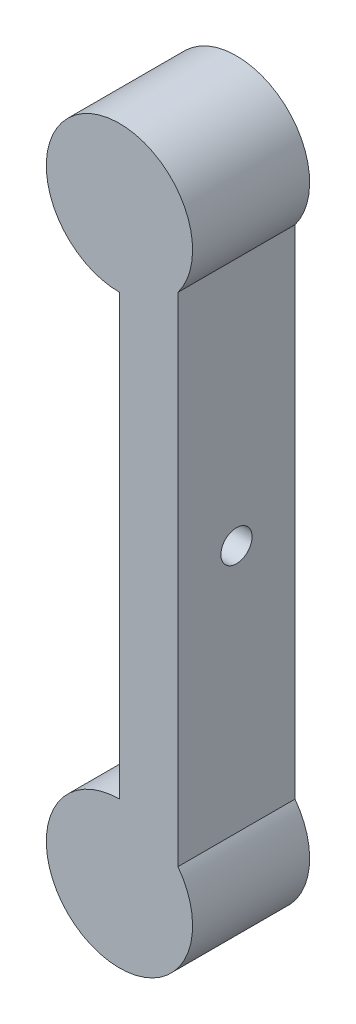
from build123d import *

# Parameters (mm, degrees)
ESBO_O1_R                = 4
RESSALTO_EXTRUS_O1_DEPTH = 10
RESSALTO_EXTRUS_O2_DEPTH = 2
ESBO_O2_R                = 1.6
CORTE_EXTRUS_O1_DEPTH    = 10


with BuildPart() as part:
    # Esboço1 → Ressalto-extrusão1 (new body)
    with BuildSketch(Plane.XY):
        with BuildLine():
            Line((6, 4.5), (6, 55.5))
            ThreePointArc((6, 55.5), (-3.354101966, 66.708203932), (0, 52.5))
            Line((0, 52.5), (0, 7.5))
            ThreePointArc((0, 7.5), (-3.354101966, -6.708203932), (6, 4.5))
        make_face()
        Circle(ESBO_O1_R, mode=Mode.SUBTRACT)
        with Locations((0, 60)):
            Circle(ESBO_O1_R, mode=Mode.SUBTRACT)
    extrude(amount=RESSALTO_EXTRUS_O1_DEPTH)

    # Esboço3 → Ressalto-extrusão2 (add)
    with BuildSketch(Plane.XY.offset(10)):
        with BuildLine():
            Line((0, 52.5), (0, 7.5))
            ThreePointArc((0, 7.5), (-3.354101966, -6.708203932), (6, 4.5))
            Line((6, 4.5), (6, 55.5))
            ThreePointArc((6, 55.5), (-3.354101966, 66.708203932), (0, 52.5))
        make_face()
    extrude(amount=RESSALTO_EXTRUS_O2_DEPTH)

    # Esboço2 → Corte-extrusão1 (cut)
    with BuildSketch(Plane.ZY):
        with Locations(Location((6, 30, 0), (0, 0, 270))):
            Circle(ESBO_O2_R)
    extrude(amount=-CORTE_EXTRUS_O1_DEPTH, mode=Mode.SUBTRACT)


solid = part.part
